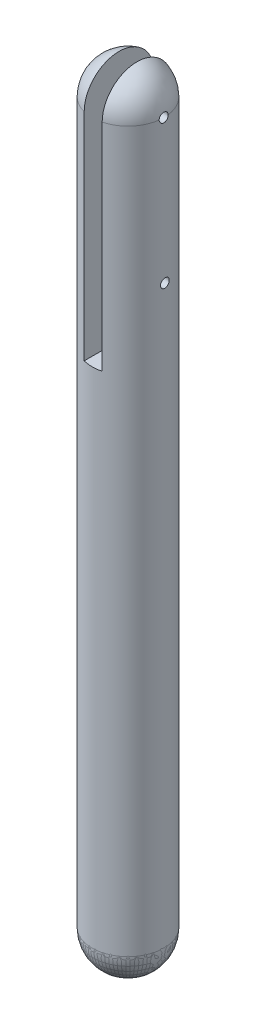
from build123d import *

# Parameters (mm, degrees)
CUT_EXTRUDE2_DEPTH      = 111.905365064
CUT_EXTRUDE2_DEPTH_BACK = 111.905365064
SKETCH3_W               = 5
SKETCH3_H               = 70
CUT_EXTRUDE3_DEPTH      = 112.158670377
CUT_EXTRUDE3_DEPTH_BACK = 112.158670377
SKETCH4_R               = 1.25


with BuildPart() as part:
    # Sketch1 → Revolve2 (revolve)
    with BuildSketch(Plane.XY):
        with BuildLine():
            Line((0, 100), (0, 110))
            ThreePointArc((0, 110), (7.071067812, 107.071067812), (10, 100))
            Line((10, 100), (10, -100))
            ThreePointArc((10, -100), (7.071067812, -107.071067812), (0, -110))
            Line((0, -110), (0, -100))
            Line((0, -100), (0, 100))
        make_face()
    revolve(axis=Axis((0, 100, 0), (0, 1, 0)))

    # Sketch3 → Cut-Extrude2 (cut, two sides: drawn at the far end of the back side and taken through both)
    with BuildSketch(Plane.XY.offset(-CUT_EXTRUDE2_DEPTH_BACK)):
        with Locations((0, 75)):
            Rectangle(SKETCH3_W, SKETCH3_H)
    extrude(amount=CUT_EXTRUDE2_DEPTH + CUT_EXTRUDE2_DEPTH_BACK, mode=Mode.SUBTRACT)

    # Sketch4 → Cut-Extrude3 (cut, two sides: drawn at the far end of the back side and taken through both)
    with BuildSketch(Plane.ZY.offset(-2.5).offset(-CUT_EXTRUDE3_DEPTH_BACK)):
        with Locations((0, 100)):
            Circle(SKETCH4_R)
        with Locations((-0.317541634, 60.001260428)):
            Circle(SKETCH4_R)
    extrude(amount=CUT_EXTRUDE3_DEPTH + CUT_EXTRUDE3_DEPTH_BACK, mode=Mode.SUBTRACT)


with BuildPart() as body_2:
    # Sketch6 → Revolve4 (revolve)
    with BuildSketch(Plane.XY):
        with BuildLine():
            Line((0, -90), (0, -110))
            ThreePointArc((0, -110), (10, -100), (0, -90))
        make_face()
    revolve(axis=Axis((0, -90, 0), (0, -1, 0)))


solid = Compound([part.part, body_2.part])
